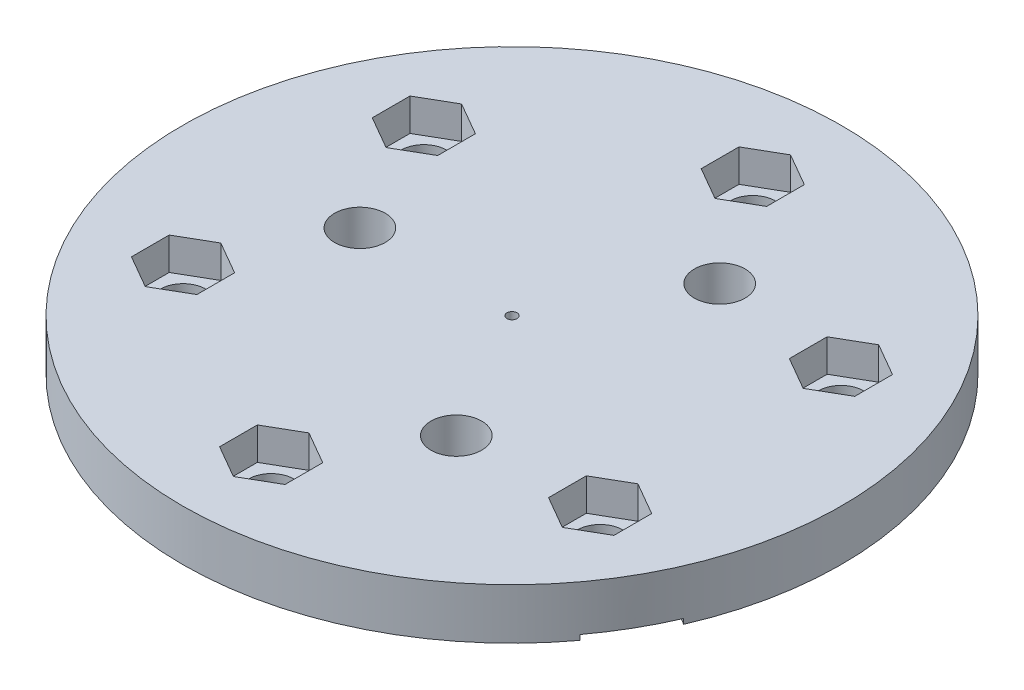
from build123d import *

# Parameters (mm, degrees)
SKETCH1_R           = 65
SKETCH1_R_2         = 1
BOSS_EXTRUDE1_DEPTH = 5
CUT_EXTRUDE1_DEPTH  = 6.4
SKETCH4_R           = 4.5
CUT_EXTRUDE2_DEPTH  = 93.146405247
CUT_EXTRUDE3_START  = -9
CUT_EXTRUDE3_DEPTH  = 3
SKETCH6_R           = 5
CUT_EXTRUDE4_DEPTH  = 93.466210045


with BuildPart() as part:
    # Sketch1 → Boss-Extrude1 (new, symmetric)
    with BuildSketch(Plane(origin=(0, 0, 0), x_dir=(1, 0, 0), z_dir=(0, 1, 0))):
        with Locations(Location((0, 0, 0), (0, 0, 270))):
            Circle(SKETCH1_R)
        with Locations(Location((0, 0, 0), (0, 0, 270))):
            Circle(SKETCH1_R_2, mode=Mode.SUBTRACT)
    extrude(amount=BOSS_EXTRUDE1_DEPTH, both=True)

    # Sketch3 → Cut-Extrude1 (cut)
    with BuildSketch(Plane(origin=(0, 5, 0), x_dir=(1, 0, 0), z_dir=(0, 1, 0))):
        Polygon((34.68620668, 20.026090764), (41.13620668, 16.302181527), (47.58620668, 20.026090764), (47.58620668, 27.473909236), (41.13620668, 31.197818473), (34.68620668, 27.473909236), align=None)
        Polygon((0, 40.052181527), (6.45, 43.776090764), (6.45, 51.223909236), (0, 54.947818473), (-6.45, 51.223909236), (-6.45, 43.776090764), align=None)
        Polygon((34.68620668, -20.026090764), (34.68620668, -27.473909236), (41.13620668, -31.197818473), (47.58620668, -27.473909236), (47.58620668, -20.026090764), (41.13620668, -16.302181527), align=None)
        Polygon((0, -40.052181527), (-6.45, -43.776090764), (-6.45, -51.223909236), (0, -54.947818473), (6.45, -51.223909236), (6.45, -43.776090764), align=None)
        Polygon((-34.68620668, -20.026090764), (-41.13620668, -16.302181527), (-47.58620668, -20.026090764), (-47.58620668, -27.473909236), (-41.13620668, -31.197818473), (-34.68620668, -27.473909236), align=None)
        Polygon((-34.68620668, 20.026090764), (-34.68620668, 27.473909236), (-41.13620668, 31.197818473), (-47.58620668, 27.473909236), (-47.58620668, 20.026090764), (-41.13620668, 16.302181527), align=None)
    extrude(amount=-CUT_EXTRUDE1_DEPTH, mode=Mode.SUBTRACT)

    # Sketch4 → Cut-Extrude2 (cut, through all)
    with BuildSketch(Plane(origin=(0, -1.4, 0), x_dir=(1, 0, 0), z_dir=(0, 1, 0))):
        with Locations(Location((0, 47.5, 0), (0, 0, 270))):
            Circle(SKETCH4_R)
        with Locations(Location((41.13620668, 23.75, 0), (0, 0, 270))):
            Circle(SKETCH4_R)
        with Locations(Location((41.13620668, -23.75, 0), (0, 0, 270))):
            Circle(SKETCH4_R)
        with Locations(Location((0, -47.5, 0), (0, 0, 270))):
            Circle(SKETCH4_R)
        with Locations(Location((-41.13620668, -23.75, 0), (0, 0, 270))):
            Circle(SKETCH4_R)
        with Locations(Location((-41.13620668, 23.75, 0), (0, 0, 270))):
            Circle(SKETCH4_R)
    extrude(amount=-CUT_EXTRUDE2_DEPTH, mode=Mode.SUBTRACT)

    # Sketch5 → Cut-Extrude3 (cut)
    with BuildSketch(Plane(origin=(0, 5, 0), x_dir=(1, 0, 0), z_dir=(0, 1, 0)).offset(CUT_EXTRUDE3_START)):
        Polygon((60.463542815, -26.248388682), (7.5, 4.330127019), (7.5, 65.487158421), (-7.5, 65.487158421), (-7.5, 4.330127019), (-60.463542815, -26.248388682), (-52.963542815, -39.238769739), (0, -8.660254038), (52.963542815, -39.238769739), align=None)
    extrude(amount=-CUT_EXTRUDE3_DEPTH, mode=Mode.SUBTRACT)

    # Sketch6 → Cut-Extrude4 (cut, through all)
    with BuildSketch(Plane.XZ.offset(5)):
        with Locations(Location((-30, 0, 0), (0, 0, 270))):
            Circle(SKETCH6_R)
        with Locations(Location((15, 25.980762114, 0), (0, 0, 270))):
            Circle(SKETCH6_R)
        with Locations(Location((15, -25.980762114, 0), (0, 0, 270))):
            Circle(SKETCH6_R)
    extrude(amount=-CUT_EXTRUDE4_DEPTH, mode=Mode.SUBTRACT)


solid = part.part
